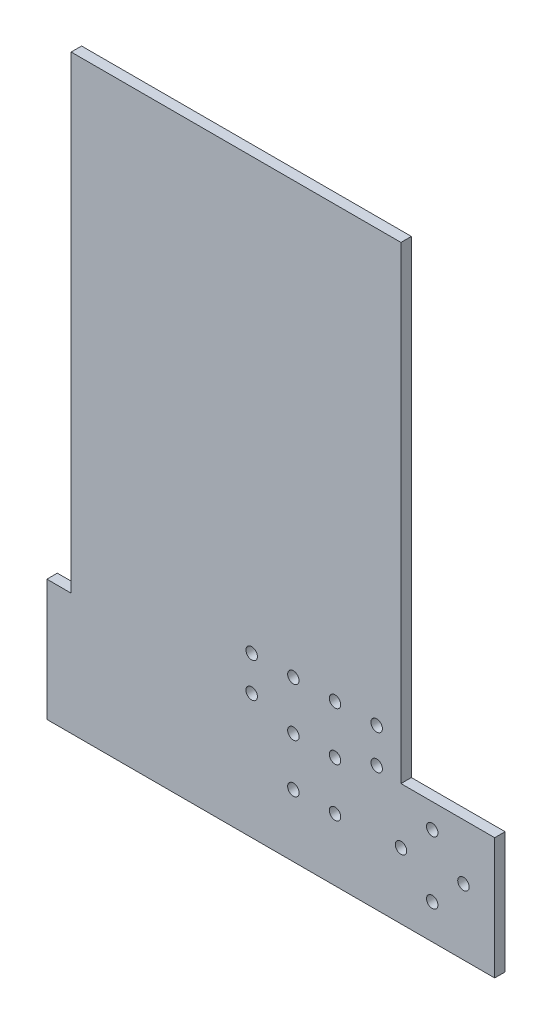
from build123d import *

# Parameters (mm, degrees)
SKETCH_1_W          = 105
SKETCH_1_H          = 35
EXTRUDE_1_DEPTH     = 3
SKETCH_3_W          = 24
SKETCH_3_H          = 35
EXTRUDE_2_DEPTH     = 3
SKETCH_4_W          = 95
SKETCH_4_H          = 135
EXTRUDE_3_DEPTH     = 3
SKETCH_5_R          = 1.65
CUT_EXTRUDE_1_DEPTH = 172.052623482
SKETCH_6_R          = 1.65
CUT_EXTRUDE_2_DEPTH = 40


with BuildPart() as part:
    # 草图1 → 凸台-拉伸1 (new body)
    with BuildSketch(Plane.XY):
        with Locations((52.5, -17.5)):
            Rectangle(SKETCH_1_W, SKETCH_1_H)
    extrude(amount=EXTRUDE_1_DEPTH)

    # 草图3 → 凸台-拉伸2 (add)
    with BuildSketch(Plane.XY.offset(3)):
        with Locations((-12, -17.5)):
            Rectangle(SKETCH_3_W, SKETCH_3_H)
    extrude(amount=-EXTRUDE_2_DEPTH)

    # 草图4 → 凸台-拉伸3 (add)
    with BuildSketch(Plane.XY.offset(3)):
        with Locations((30.5, 67.5)):
            Rectangle(SKETCH_4_W, SKETCH_4_H)
    extrude(amount=-EXTRUDE_3_DEPTH)

    # 草图5 → 切除-拉伸1 (cut, through all)
    with BuildSketch(Plane(origin=(0, 0, 0), x_dir=(-1, 0, 0), z_dir=(0, 0, -1))):
        with Locations((-87, -7)):
            Circle(SKETCH_5_R)
        with Locations((-96, -16)):
            Circle(SKETCH_5_R)
        with Locations((-87, -25)):
            Circle(SKETCH_5_R)
        with Locations((-78, -16)):
            Circle(SKETCH_5_R)
    extrude(amount=-CUT_EXTRUDE_1_DEPTH, mode=Mode.SUBTRACT)

    # 草图6 → 切除-拉伸2 (cut)
    with BuildSketch(Plane.XY.offset(3)):
        with Locations((35, 1)):
            Circle(SKETCH_6_R)
        with Locations((35, 11)):
            Circle(SKETCH_6_R)
        with Locations((71, 1)):
            Circle(SKETCH_6_R)
        with Locations((71, 11)):
            Circle(SKETCH_6_R)
        with Locations((47, -17)):
            Circle(SKETCH_6_R)
        with Locations((59, -17)):
            Circle(SKETCH_6_R)
        with Locations((59, -3)):
            Circle(SKETCH_6_R)
        with Locations((47, -3)):
            Circle(SKETCH_6_R)
        with Locations((59, 11)):
            Circle(SKETCH_6_R)
        with Locations((47, 11)):
            Circle(SKETCH_6_R)
    extrude(amount=-CUT_EXTRUDE_2_DEPTH, mode=Mode.SUBTRACT)


solid = part.part
